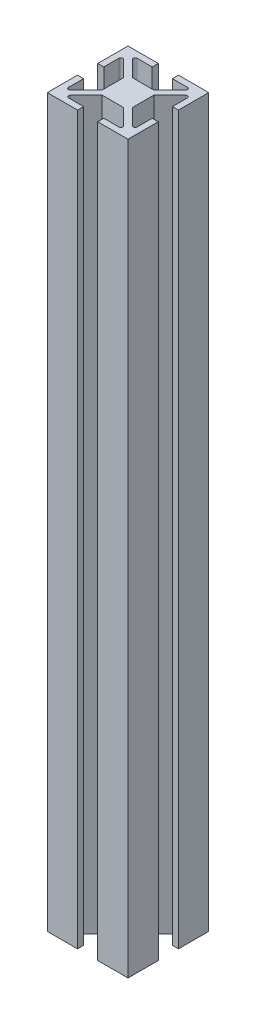
from build123d import *

# Parameters (mm, degrees)
BOSS_EXTRU_1_DEPTH = 180


with BuildPart() as part:
    # Esquisse1 → Boss.-Extru.1 (new body)
    with BuildSketch(Plane(origin=(0, 0, 0), x_dir=(1, 0, 0), z_dir=(0, 1, 0))):
        with BuildLine():
            Line((-10, -2.5), (-10, -10))
            Line((-10, -10), (-2.5, -10))
            Line((-2.5, -10), (-2.5, -8.5))
            Line((-2.5, -8.5), (-6.232233047, -8.5))
            ThreePointArc((-6.232233047, -8.5), (-6.694172813, -8.191341716), (-6.585786438, -7.646446609))
            Line((-6.585786438, -7.646446609), (-2.689339828, -3.75))
            Line((-2.689339828, -3.75), (2.689339828, -3.75))
            Line((2.689339828, -3.75), (6.585786438, -7.646446609))
            ThreePointArc((6.585786438, -7.646446609), (6.694172813, -8.191341716), (6.232233047, -8.5))
            Line((6.232233047, -8.5), (2.5, -8.5))
            Line((2.5, -8.5), (2.5, -10))
            Line((2.5, -10), (10, -10))
            Line((10, -10), (10, -2.5))
            Line((10, -2.5), (8.5, -2.5))
            Line((8.5, -2.5), (8.5, -6.232233047))
            ThreePointArc((8.5, -6.232233047), (8.191341716, -6.694172813), (7.646446609, -6.585786438))
            Line((7.646446609, -6.585786438), (3.75, -2.689339828))
            Line((3.75, -2.689339828), (3.75, 2.689339828))
            Line((3.75, 2.689339828), (7.646446609, 6.585786438))
            ThreePointArc((7.646446609, 6.585786438), (8.191341716, 6.694172813), (8.5, 6.232233047))
            Line((8.5, 6.232233047), (8.5, 2.5))
            Line((8.5, 2.5), (10, 2.5))
            Line((10, 2.5), (10, 10))
            Line((10, 10), (2.5, 10))
            Line((2.5, 10), (2.5, 8.5))
            Line((2.5, 8.5), (6.232233047, 8.5))
            ThreePointArc((6.232233047, 8.5), (6.694172813, 8.191341716), (6.585786438, 7.646446609))
            Line((6.585786438, 7.646446609), (2.689339828, 3.75))
            Line((2.689339828, 3.75), (-2.689339828, 3.75))
            Line((-2.689339828, 3.75), (-6.585786438, 7.646446609))
            ThreePointArc((-6.585786438, 7.646446609), (-6.694172813, 8.191341716), (-6.232233047, 8.5))
            Line((-6.232233047, 8.5), (-2.5, 8.5))
            Line((-2.5, 8.5), (-2.5, 10))
            Line((-2.5, 10), (-10, 10))
            Line((-10, 10), (-10, 2.5))
            Line((-10, 2.5), (-8.5, 2.5))
            Line((-8.5, 2.5), (-8.5, 6.232233047))
            ThreePointArc((-8.5, 6.232233047), (-8.191341716, 6.694172813), (-7.646446609, 6.585786438))
            Line((-7.646446609, 6.585786438), (-3.75, 2.689339828))
            Line((-3.75, 2.689339828), (-3.75, -2.689339828))
            Line((-3.75, -2.689339828), (-7.646446609, -6.585786438))
            ThreePointArc((-7.646446609, -6.585786438), (-8.191341716, -6.694172813), (-8.5, -6.232233047))
            Line((-8.5, -6.232233047), (-8.5, -2.5))
            Line((-8.5, -2.5), (-10, -2.5))
        make_face()
    extrude(amount=BOSS_EXTRU_1_DEPTH)


solid = part.part
